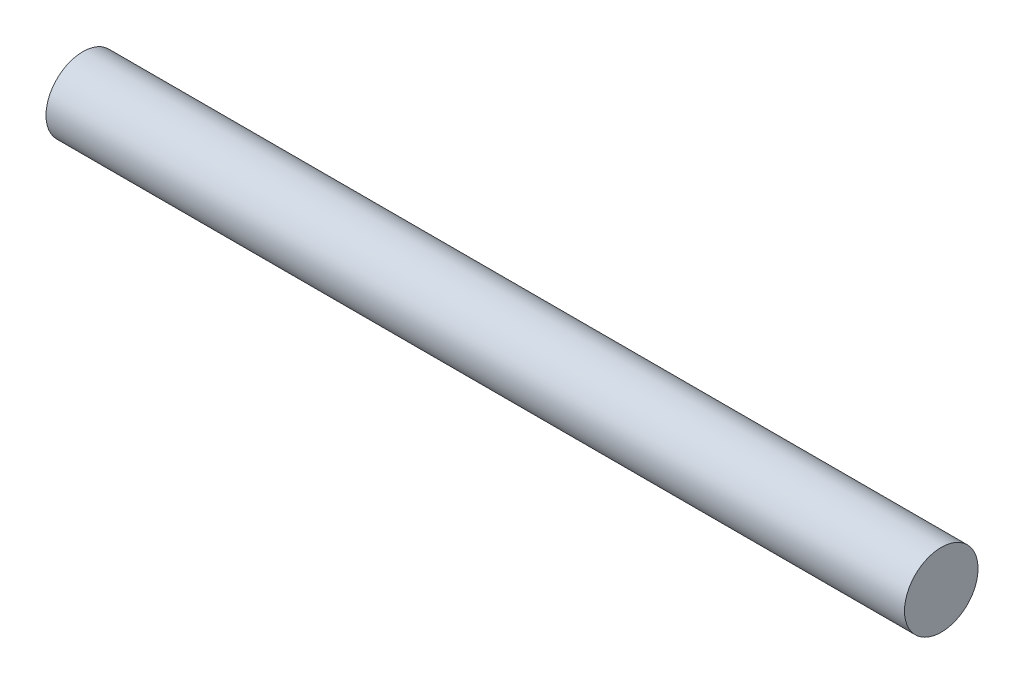
from build123d import *

# Parameters (mm, degrees)
ESQUISSE1_W = 140
ESQUISSE1_H = 6


with BuildPart() as part:
    # Esquisse1 → Révolution1 (revolve)
    with BuildSketch(Plane(origin=(0, 0, 0), x_dir=(1, 0, 0), z_dir=(0, 1, 0)), mode=Mode.PRIVATE) as r_volution1_sk:
        with Locations((0, 3)):
            Rectangle(ESQUISSE1_W, ESQUISSE1_H)
    revolve(r_volution1_sk.sketch.rotate(Axis((-70, 0, 0), (1, 0, 0)), 180), axis=Axis((-70, 0, 0), (1, 0, 0)))


solid = part.part
